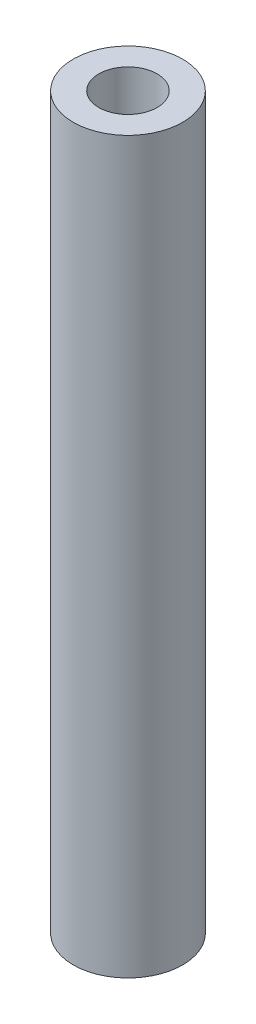
from build123d import *

# Parameters (mm, degrees)
SK_1_R       = 3
SK_1_R_2     = 1.6
SPACER_DEPTH = 40


with BuildPart() as part:
    # SK_1 → Spacer (new body)
    with BuildSketch(Plane(origin=(0, 0, 0), x_dir=(1, 0, 0), z_dir=(0, 1, 0))):
        with Locations(Location((0, 0, 0), (0, 0, 270))):
            Circle(SK_1_R)
        with Locations(Location((0, 0, 0), (0, 0, 270))):
            Circle(SK_1_R_2, mode=Mode.SUBTRACT)
    extrude(amount=SPACER_DEPTH)


solid = part.part
